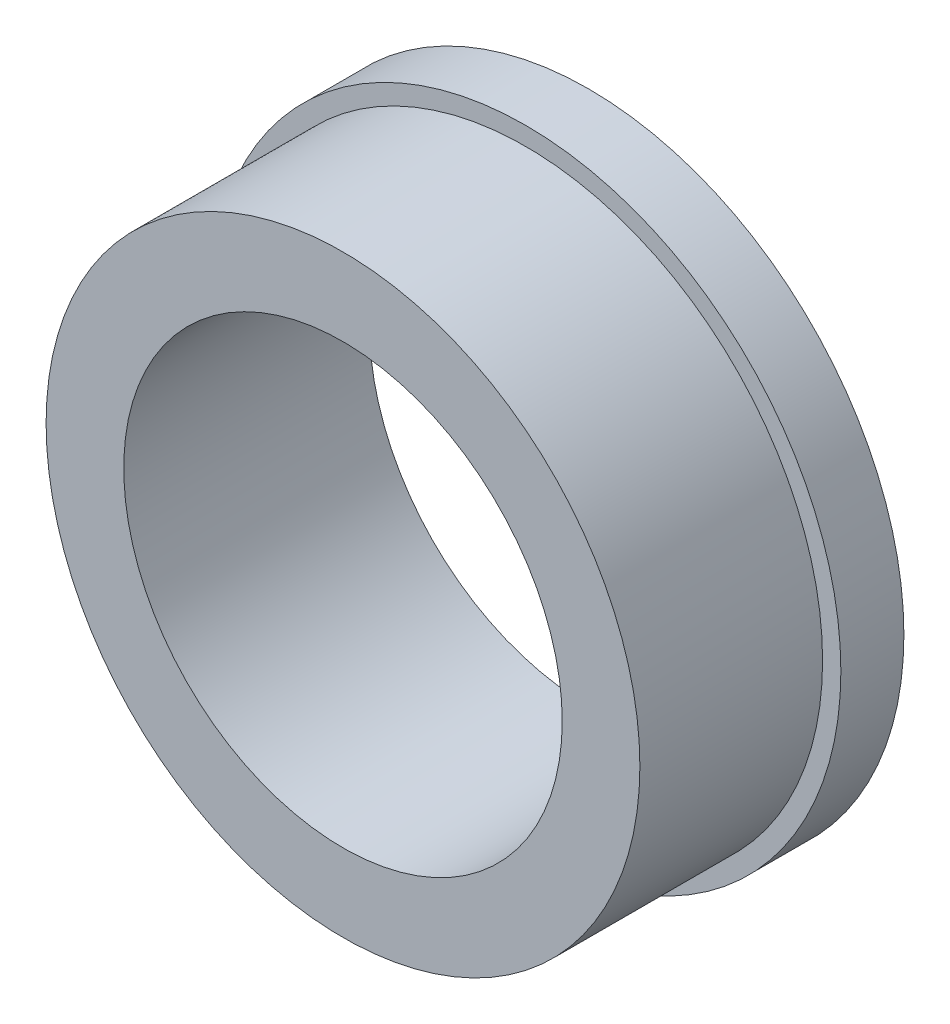
from build123d import *

# Parameters (mm, degrees)
CROQUIS1_R              = 6.9
SALIENTE_EXTRUIR3_DEPTH = 5.38
CROQUIS4_OUTSIDE_W      = 19.848
CROQUIS4_OUTSIDE_H      = 19.848
CROQUIS4_OUTSIDE_R      = 6.5
CORTAR_EXTRUIR2_DEPTH   = 4
CORTAR_EXTRUIR3_REACH   = 13.143
CROQUIS5_R              = 4.8


with BuildPart() as part:
    # Croquis1 → Saliente-Extruir3 (new body)
    with BuildSketch(Plane.XY):
        Circle(CROQUIS1_R)
    extrude(amount=SALIENTE_EXTRUIR3_DEPTH)

    # Croquis4 outside → Cortar-Extruir2 (cut)
    with BuildSketch(Plane.XY.offset(5.38)):
        Rectangle(CROQUIS4_OUTSIDE_W, CROQUIS4_OUTSIDE_H)
        Circle(CROQUIS4_OUTSIDE_R, mode=Mode.SUBTRACT)
    extrude(amount=-CORTAR_EXTRUIR2_DEPTH, mode=Mode.SUBTRACT)

    # Croquis5 → Cortar-Extruir3 (cut, up to next)
    with BuildSketch(Plane.XY.offset(5.38), mode=Mode.PRIVATE) as cortar_extruir3_sk1:
        Circle(CROQUIS5_R)
    cortar_extruir3_tool1 = extrude(cortar_extruir3_sk1.sketch, amount=-CORTAR_EXTRUIR3_REACH, mode=Mode.PRIVATE) & part.part
    add(cortar_extruir3_tool1.solids().sort_by_distance((0, 0, 5.38))[0], mode=Mode.SUBTRACT)


solid = part.part
